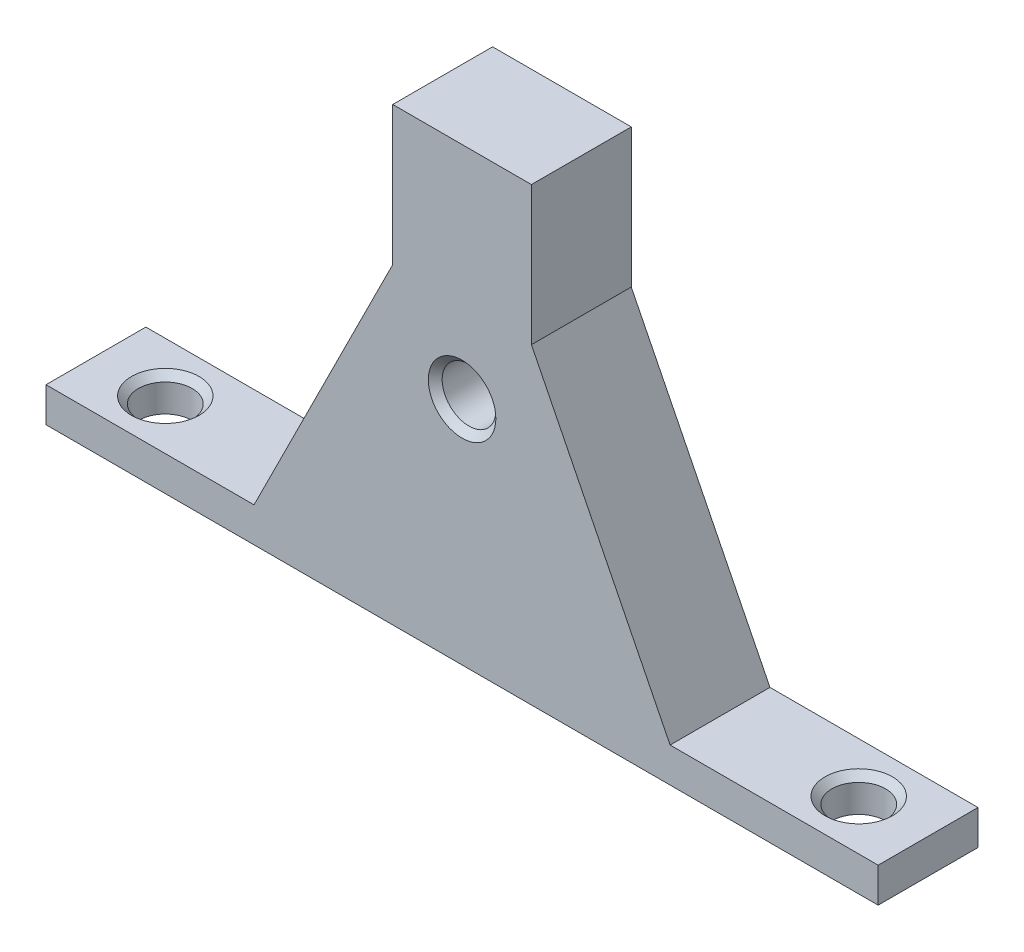
from build123d import *

# Parameters (mm, degrees)
SKETCH1_W                       = 76.2
SKETCH1_H                       = 9.144
BOSS_EXTRUDE1_DEPTH             = 3.175
F_8_CLEARANCE_HOLE1_D           = 4.9149
F_8_CLEARANCE_HOLE1_CSINK_D     = 6.1849
F_8_CLEARANCE_HOLE1_CSINK_ANGLE = 90
BOSS_EXTRUDE2_DEPTH             = 9.144
F_8_CLEARANCE_HOLE2_D           = 4.9149
F_8_CLEARANCE_HOLE2_CSINK_D     = 6.1849
F_8_CLEARANCE_HOLE2_CSINK_ANGLE = 90


with BuildPart() as part:
    # Sketch1 → Boss-Extrude1 (new body)
    with BuildSketch(Plane(origin=(0, 0, 0), x_dir=(1, 0, 0), z_dir=(0, 1, 0))):
        Rectangle(SKETCH1_W, SKETCH1_H)
    extrude(amount=BOSS_EXTRUDE1_DEPTH)

    # #8 Clearance Hole1 (through all)
    with Locations(Plane(origin=(0, 3.175, 0), x_dir=(1, 0, 0), z_dir=(0, 1, 0))):
        with Locations((-31.75, 0), (31.75, 0)):
            CounterSinkHole(F_8_CLEARANCE_HOLE1_D / 2, F_8_CLEARANCE_HOLE1_CSINK_D / 2, counter_sink_angle=F_8_CLEARANCE_HOLE1_CSINK_ANGLE)

    # Sketch4 → Boss-Extrude2 (add)
    with BuildSketch(Plane.XY.offset(4.572)):
        Polygon((-6.35, 28.575), (-19.05, 3.175), (0, 3.175), (0, 41.275), (-6.35, 41.275), align=None)
        Polygon((0, 41.275), (0, 3.175), (19.05, 3.175), (6.35, 28.575), (6.35, 41.275), align=None)
    extrude(amount=-BOSS_EXTRUDE2_DEPTH)

    # #8 Clearance Hole2 (through all)
    with Locations(Plane.XY.offset(4.572)):
        with Locations((0, 21.082)):
            CounterSinkHole(F_8_CLEARANCE_HOLE2_D / 2, F_8_CLEARANCE_HOLE2_CSINK_D / 2, counter_sink_angle=F_8_CLEARANCE_HOLE2_CSINK_ANGLE)


solid = part.part
